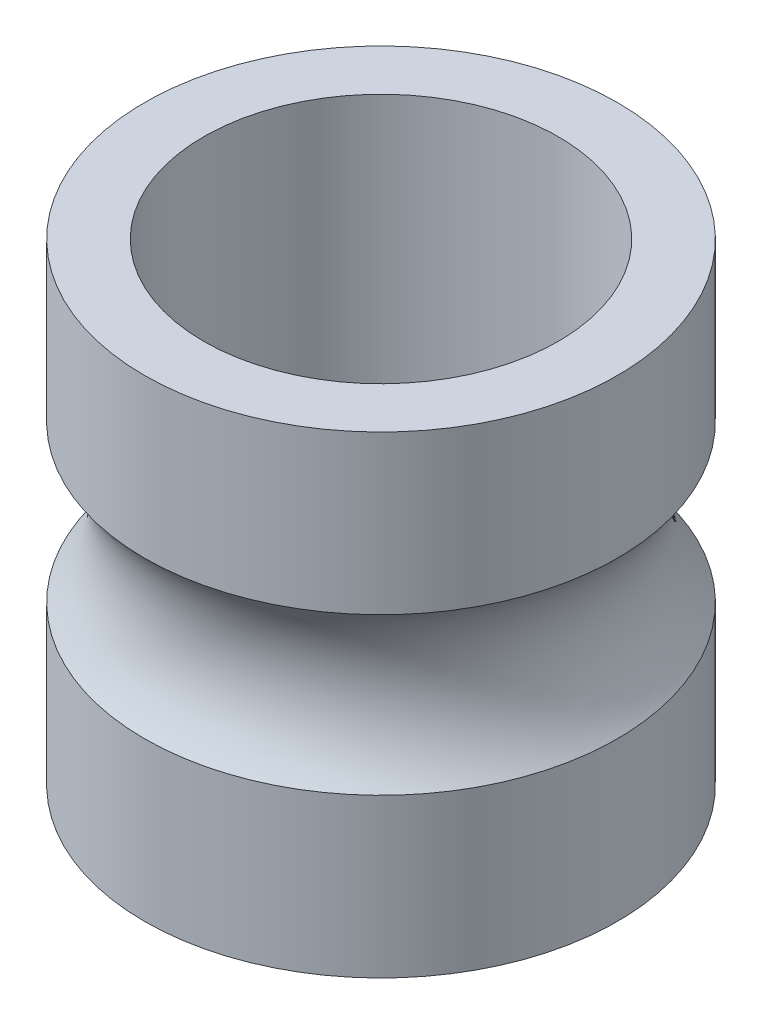
from build123d import *

# Parameters (mm, degrees)
DIAPROFILES_R         = 2
DIAPROFILES_R_2       = 1.5
DIAPROFILE_DEPTH      = 2
BEARINGPATHPROFILES_R = 1


with BuildPart() as part:
    # DiaProfileS → DiaProfile (new, symmetric)
    with BuildSketch(Plane(origin=(0, 0, 0), x_dir=(1, 0, 0), z_dir=(0, 1, 0))):
        with Locations(Location((0, 0, 0), (0, 0, 270))):
            Circle(DIAPROFILES_R)
        with Locations(Location((0, 0, 0), (0, 0, 270))):
            Circle(DIAPROFILES_R_2, mode=Mode.SUBTRACT)
    extrude(amount=DIAPROFILE_DEPTH, both=True)

    # BearingPathProfileS → BearingPathProfile (revolve, cut)
    with BuildSketch(Plane.XY, mode=Mode.PRIVATE) as bearingpathprofile_sk:
        with Locations((2.75, 0)):
            Circle(BEARINGPATHPROFILES_R)
    revolve(bearingpathprofile_sk.sketch.rotate(Axis((0, 2, 0), (0, -1, 0)), 90), axis=Axis((0, 2, 0), (0, -1, 0)), mode=Mode.SUBTRACT)


solid = part.part
